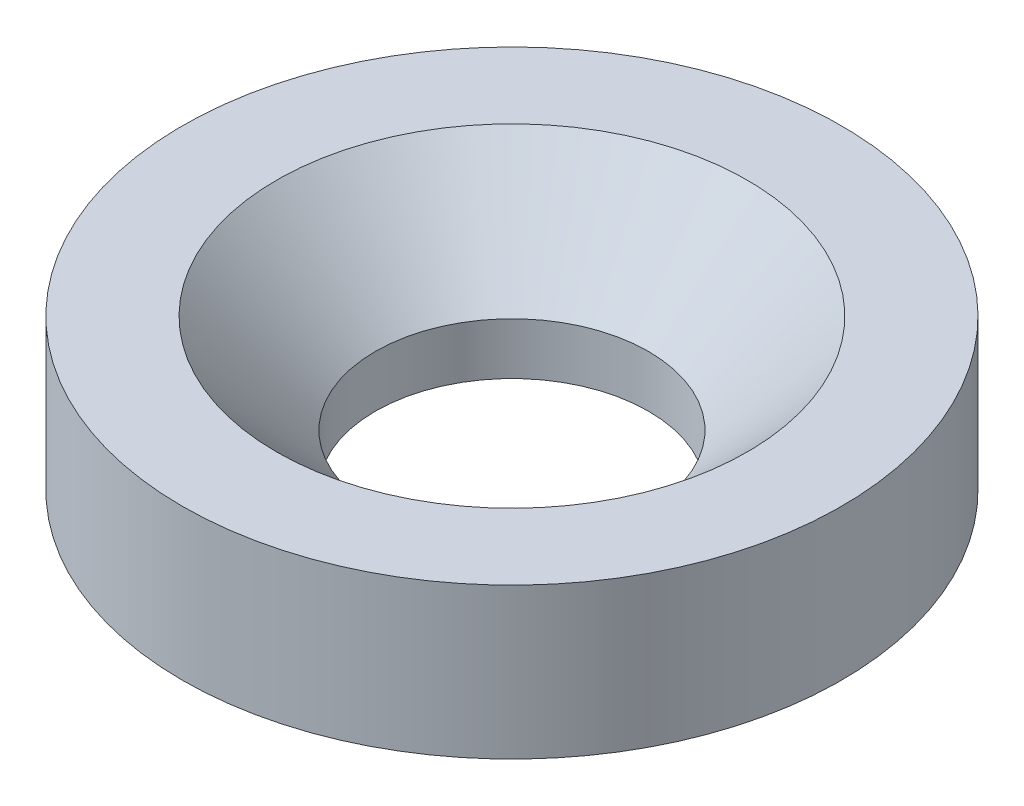
from build123d import *


with BuildPart() as part:
    # Sketch1 → Revolve1 (revolve)
    with BuildSketch(Plane.XY, mode=Mode.PRIVATE) as revolve1_sk:
        Polygon((7.25, 0), (17.5, 0), (17.5, 8), (12.5, 8), (7.25, 2.75), align=None)
    revolve(revolve1_sk.sketch.rotate(Axis((0, 16.992012475, 0), (0, -1, 0)), 90), axis=Axis((0, 16.992012475, 0), (0, -1, 0)))


solid = part.part
